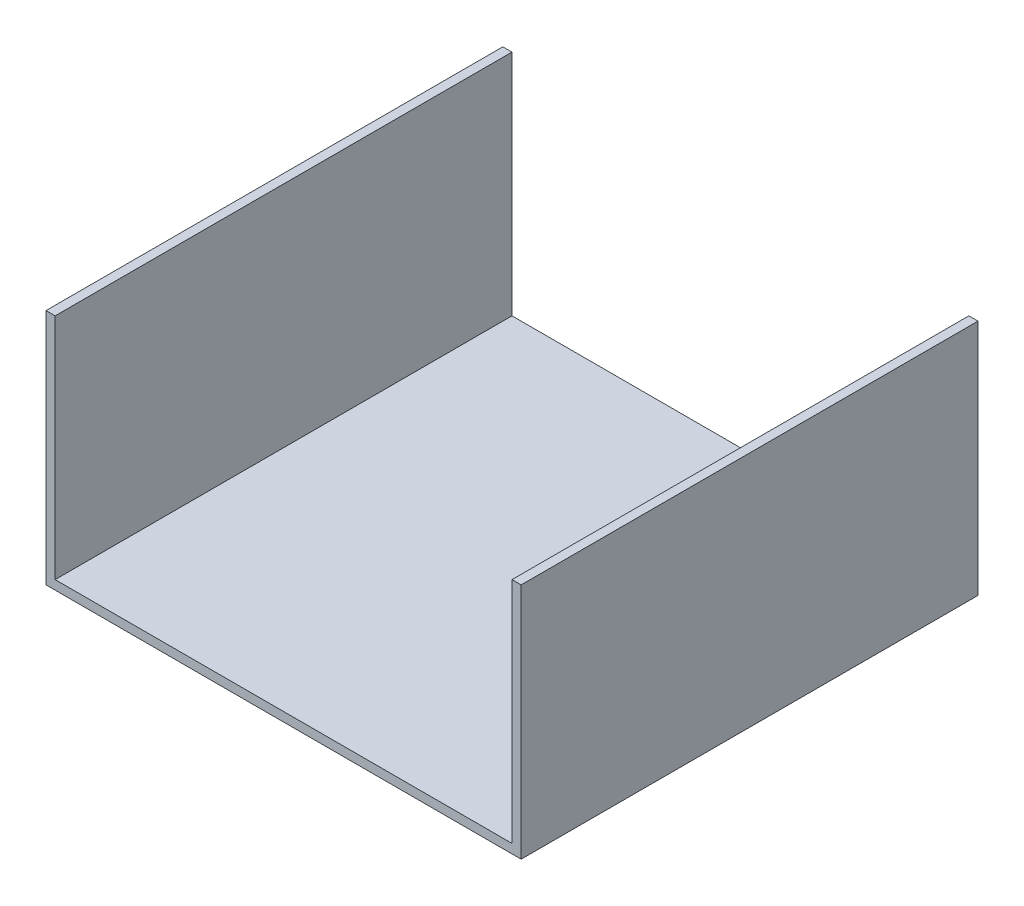
from build123d import *

# Parameters (mm, degrees)
BOSS_EXTRUDE1_DEPTH = 10000


with BuildPart() as part:
    # Sketch2 → Boss-Extrude1 (new body)
    with BuildSketch(Plane.XY):
        Polygon((0, 0), (0, -5000), (10000, -5000), (10000, 0), (10200, 0), (10200, -5200), (-200, -5200), (-200, 0), align=None)
    extrude(amount=-BOSS_EXTRUDE1_DEPTH)


solid = part.part
